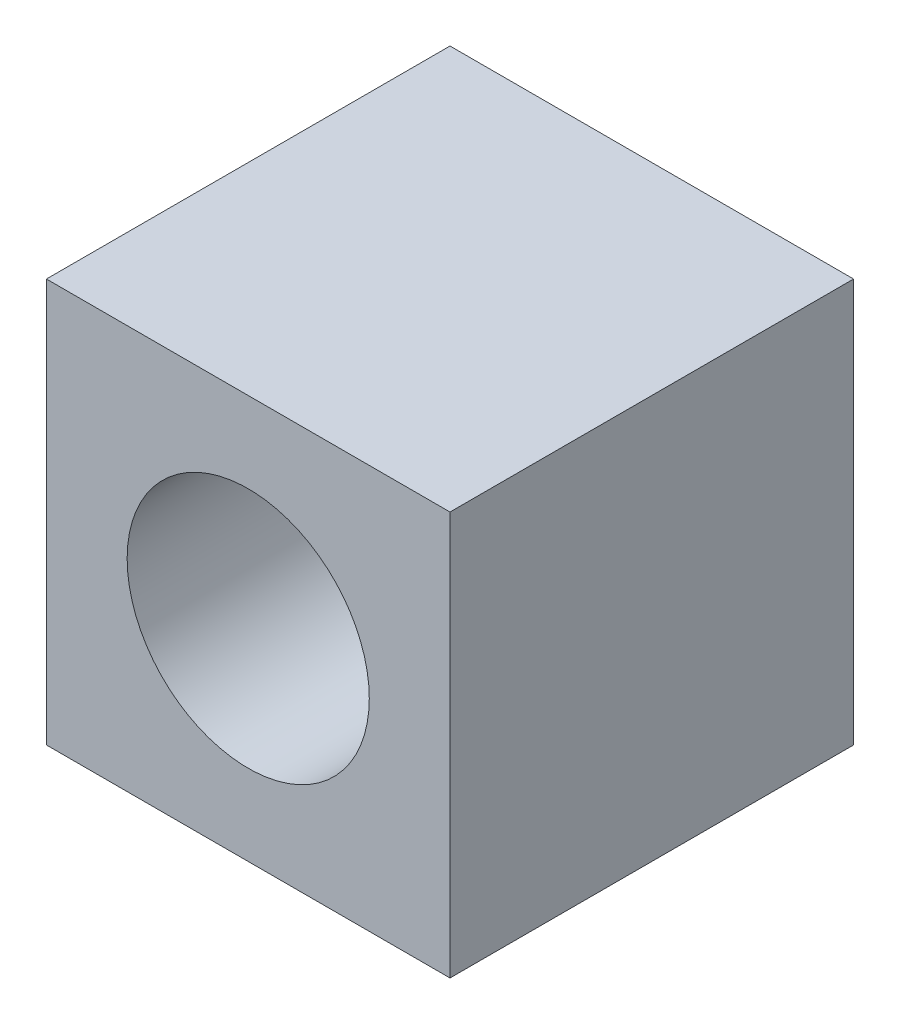
from build123d import *

# Parameters (mm, degrees)
SKETCH_1_W          = 10
SKETCH_1_H          = 10
EXTRUDE_1_DEPTH     = 10
SKETCH_2_R          = 3
CUT_EXTRUDE_1_DEPTH = 5


with BuildPart() as part:
    # 草图1 → 凸台-拉伸1 (new body)
    with BuildSketch(Plane.XY):
        with Locations((5, 5)):
            Rectangle(SKETCH_1_W, SKETCH_1_H)
    extrude(amount=EXTRUDE_1_DEPTH)

    # 草图2 → 切除-拉伸1 (cut)
    with BuildSketch(Plane.XY.offset(10)):
        with Locations((5, 5)):
            Circle(SKETCH_2_R)
    extrude(amount=-CUT_EXTRUDE_1_DEPTH, mode=Mode.SUBTRACT)


solid = part.part
